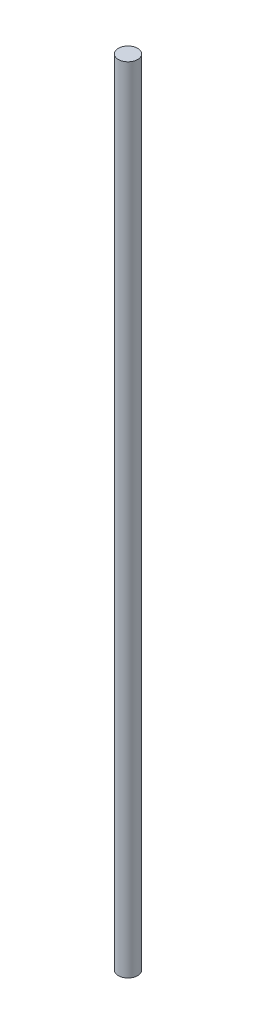
from build123d import *

# Parameters (mm, degrees)
SKETCH1_R           = 3.175
BOSS_EXTRUDE1_DEPTH = 260.35


with BuildPart() as part:
    # Sketch1 → Boss-Extrude1 (new body)
    with BuildSketch(Plane(origin=(0, 0, 0), x_dir=(1, 0, 0), z_dir=(0, 1, 0))):
        Circle(SKETCH1_R)
    extrude(amount=BOSS_EXTRUDE1_DEPTH)


solid = part.part
